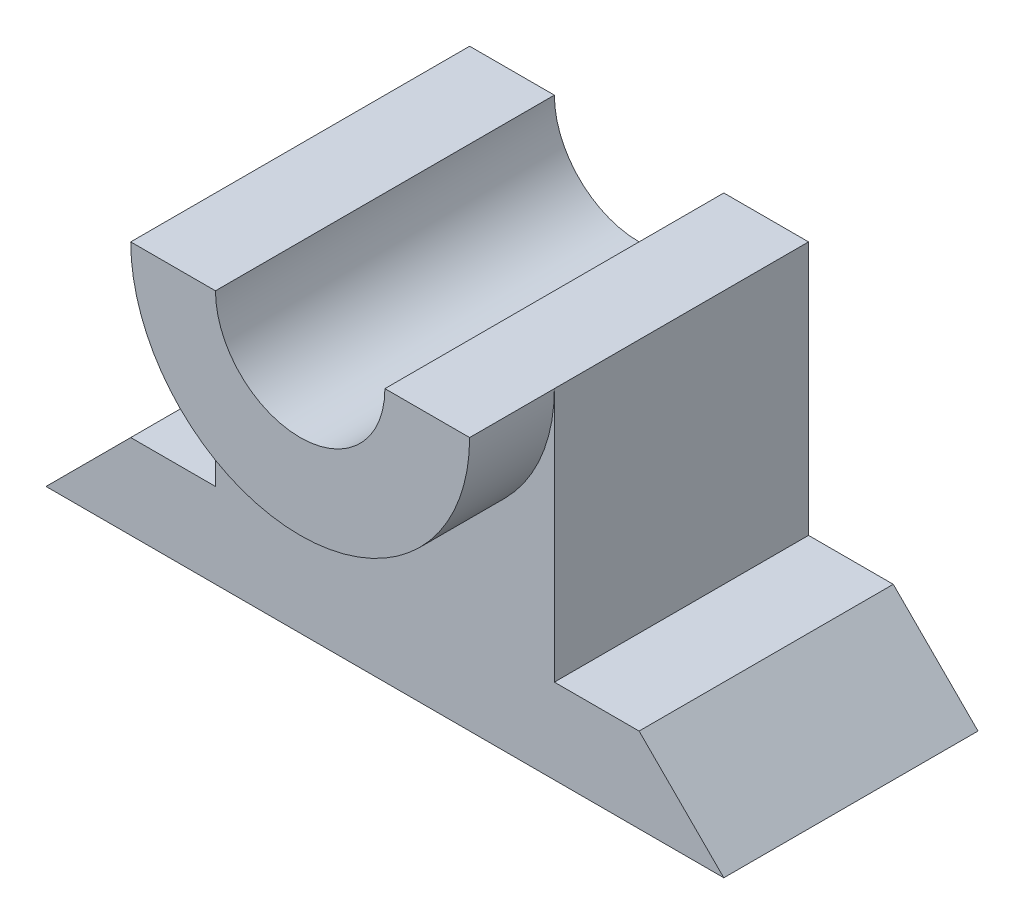
from build123d import *

# Parameters (mm, degrees)
BOSS_EXTRUDE7_DEPTH = 30
BOSS_EXTRUDE8_START = 10
BOSS_EXTRUDE8_DEPTH = 10


with BuildPart() as part:
    # Sketch1 → Boss-Extrude7 (new body)
    with BuildSketch(Plane.XY):
        with BuildLine():
            Line((20, -30), (20, 0))
            Line((20, 0), (10, 0))
            ThreePointArc((10, 0), (0, -10), (-10, 0))
            Line((-10, 0), (-20, 0))
            Line((-20, 0), (-20, -30))
            Line((-20, -30), (-30, -30))
            Line((-30, -30), (-40, -40))
            Line((-40, -40), (40, -40))
            Line((40, -40), (30, -30))
            Line((30, -30), (20, -30))
        make_face()
    extrude(amount=-BOSS_EXTRUDE7_DEPTH)

    # Sketch1<11> → Boss-Extrude8 (add)
    with BuildSketch(Plane.XY.offset(BOSS_EXTRUDE8_START)):
        with BuildLine():
            Line((-10, 0), (-20, 0))
            ThreePointArc((-20, 0), (0, -20), (20, 0))
            Line((20, 0), (10, 0))
            ThreePointArc((10, 0), (0, -10), (-10, 0))
        make_face()
    extrude(amount=-BOSS_EXTRUDE8_DEPTH)


solid = part.part
